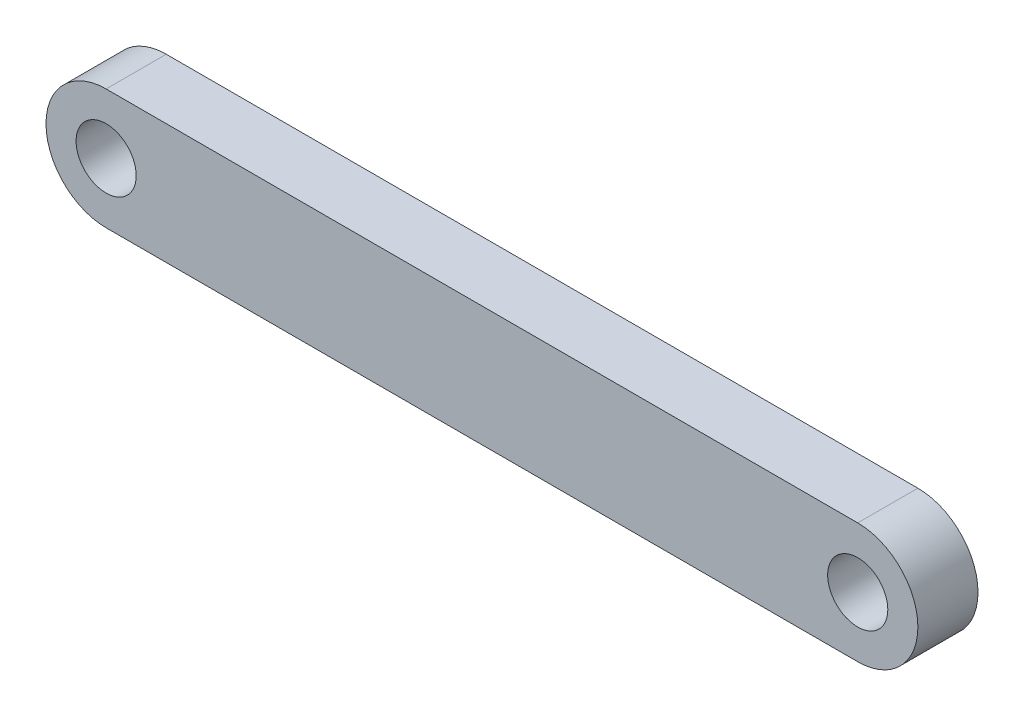
from build123d import *

# Parameters (mm, degrees)
BOSS_EXTRUDE1_DEPTH      = 1.27
BOSS_EXTRUDE1_DEPTH_BACK = 1.27
SKETCH1_R                = 1.27


with BuildPart() as part:
    # Sketch1 → Boss-Extrude1 (new, two sides: drawn at the far end of the back side and taken through both)
    with BuildSketch(Plane.XY.offset(-BOSS_EXTRUDE1_DEPTH_BACK)):
        with BuildLine():
            Line((-15.875, 2.54), (15.875, 2.54))
            ThreePointArc((15.875, 2.54), (18.415, 0), (15.875, -2.54))
            Line((15.875, -2.54), (-15.875, -2.54))
            ThreePointArc((-15.875, -2.54), (-18.415, 0), (-15.875, 2.54))
        make_face()
        with Locations((-15.875, 0)):
            Circle(SKETCH1_R, mode=Mode.SUBTRACT)
        with Locations((15.875, 0)):
            Circle(SKETCH1_R, mode=Mode.SUBTRACT)
    extrude(amount=BOSS_EXTRUDE1_DEPTH + BOSS_EXTRUDE1_DEPTH_BACK)


solid = part.part
